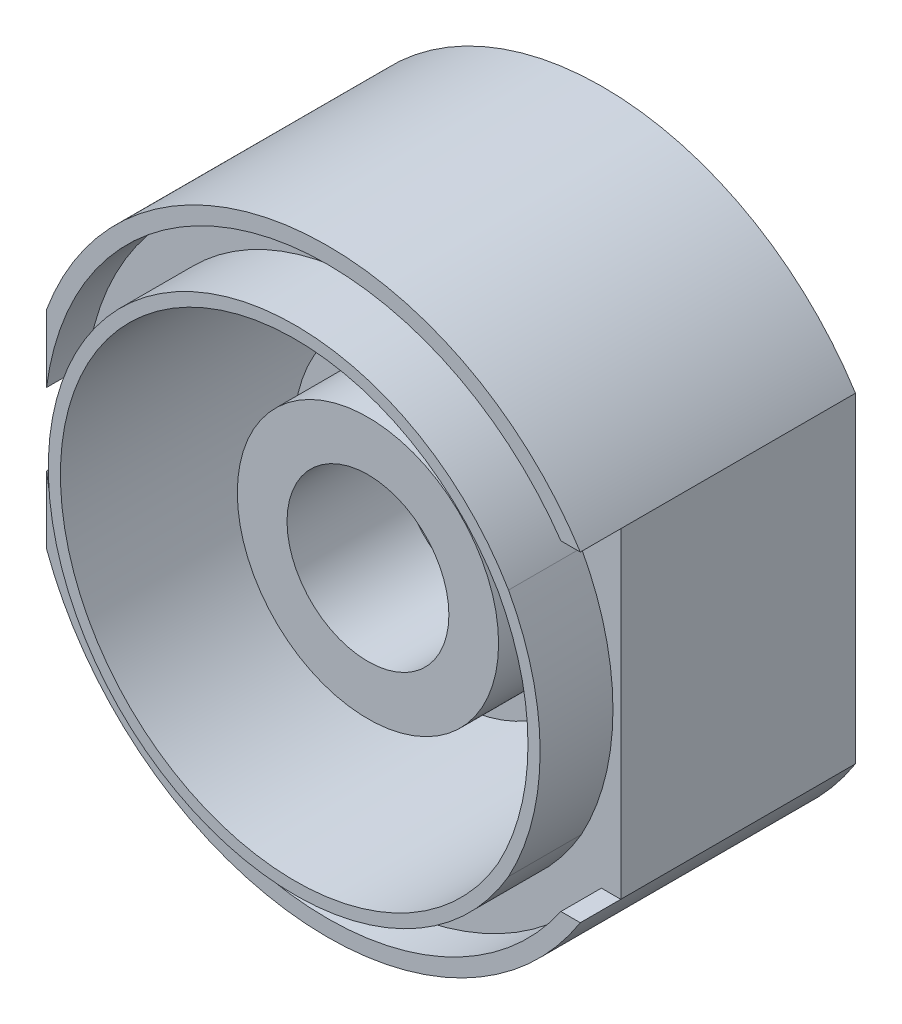
from build123d import *

# Parameters (mm, degrees)
BOSS_EXTRUDE1_DEPTH     = 17
CUT_EXTRUDE1_DEPTH      = 2.5
SKETCH5_W               = 2.5
SKETCH5_H               = 19.830535888
CUT_EXTRUDE2_DEPTH      = 2.5
EXTRUDE_THIN1_DEPTH     = 4.5
SKETCH8_R               = 8.5
CUT_EXTRUDE4_DEPTH      = 6.5
SKETCH9_R               = 5
CUT_EXTRUDE5_DEPTH      = 27.5
CUT_EXTRUDE6_DEPTH      = 0.5
CUT_EXTRUDE6_DEPTH_BACK = 1
SKETCH10_R              = 6
CUT_EXTRUDE7_START      = -12.5
SKETCH14_R              = 9.571158882
CUT_EXTRUDE7_DEPTH      = 12.5
SKETCH12_R              = 10.071158882
SKETCH12_R_2            = 8.071158882
CUT_EXTRUDE_THIN1_DEPTH = 5
SKETCH15_W              = 2.588485832
SKETCH15_H              = 17.190343429
CUT_EXTRUDE8_DEPTH      = 31.5


with BuildPart() as part:
    # Sketch1 → Boss-Extrude1 (new body)
    with BuildSketch(Plane.XY):
        with BuildLine():
            Line((17.875866164, 9.915267944), (17.875866164, -9.915267944))
            ThreePointArc((17.875866164, -9.915267944), (-16.242631254, 0), (17.875866164, 9.915267944))
        make_face()
    extrude(amount=BOSS_EXTRUDE1_DEPTH)

    # Sketch4 → Cut-Extrude1 (cut)
    with BuildSketch(Plane.XY.offset(17)):
        with BuildLine():
            Line((16.875866164, -9.620266797), (16.875866164, 9.620266797))
            ThreePointArc((16.875866164, 9.620266797), (-15.242631254, 0), (16.875866164, -9.620266797))
        make_face()
    extrude(amount=-CUT_EXTRUDE1_DEPTH, mode=Mode.SUBTRACT)

    # Sketch5 → Cut-Extrude2 (cut)
    with BuildSketch(Plane(origin=(17.875866164, 0, 0), x_dir=(0, 0, -1), z_dir=(1, 0, 0))):
        with Locations((-15.75, 0)):
            Rectangle(SKETCH5_W, SKETCH5_H)
    extrude(amount=-CUT_EXTRUDE2_DEPTH, mode=Mode.SUBTRACT)

    # Sketch6 → Extrude-Thin1 (add)
    with BuildSketch(Plane.XY.offset(14.5)):
        with BuildLine():
            ThreePointArc((15.440925449, 7.665267944), (17.39404784, 0), (15.440925449, -7.665267944))
            ThreePointArc((15.440925449, -7.665267944), (-12.992631254, 0), (15.440925449, 7.665267944))
        make_face()
        with BuildLine():
            ThreePointArc((14.787338867, 7.297249398), (16.64404784, 0), (14.787338867, -7.297249398))
            ThreePointArc((14.787338867, -7.297249398), (-12.242631254, 0), (14.787338867, 7.297249398))
        make_face(mode=Mode.SUBTRACT)
    extrude(amount=EXTRUDE_THIN1_DEPTH)

    # Sketch8 → Cut-Extrude4 (cut)
    with BuildSketch(Plane(origin=(0, 0, 0), x_dir=(-1, 0, 0), z_dir=(0, 0, -1))):
        with Locations((-2.257368746, 0)):
            Circle(SKETCH8_R)
    extrude(amount=-CUT_EXTRUDE4_DEPTH, mode=Mode.SUBTRACT)

    # Sketch9 → Cut-Extrude5 (cut)
    with BuildSketch(Plane(origin=(0, 0, 6.5), x_dir=(-1, 0, 0), z_dir=(0, 0, -1))):
        with Locations((-2.257368746, 0)):
            Circle(SKETCH9_R)
    extrude(amount=-CUT_EXTRUDE5_DEPTH, mode=Mode.SUBTRACT)

    # Sketch10 → Cut-Extrude6 (cut, two sides: drawn at the far end of the back side and taken through both)
    with BuildSketch(Plane(origin=(0, 0, 6.5), x_dir=(-1, 0, 0), z_dir=(0, 0, -1)).offset(-CUT_EXTRUDE6_DEPTH_BACK)):
        with Locations((-2.257368746, 0)):
            Circle(SKETCH10_R)
    extrude(amount=CUT_EXTRUDE6_DEPTH + CUT_EXTRUDE6_DEPTH_BACK, mode=Mode.SUBTRACT)

    # Sketch14 → Cut-Extrude7 (cut)
    with BuildSketch(Plane.XY.offset(14.5).offset(CUT_EXTRUDE7_START)):
        with BuildLine():
            ThreePointArc((14.787338867, 7.297249398), (-12.242631254, 0), (14.787338867, -7.297249398))
            ThreePointArc((14.787338867, -7.297249398), (16.64404784, 0), (14.787338867, 7.297249398))
        make_face()
        with Locations((2.257368746, 0)):
            Circle(SKETCH14_R, mode=Mode.SUBTRACT)
    extrude(amount=CUT_EXTRUDE7_DEPTH, mode=Mode.SUBTRACT)

    # Sketch12 → Cut-Extrude-Thin1 (cut)
    with BuildSketch(Plane.XY.offset(14.5)):
        with Locations((2.257368746, 0)):
            Circle(SKETCH12_R)
        with Locations((2.257368746, 0)):
            Circle(SKETCH12_R_2, mode=Mode.SUBTRACT)
    extrude(amount=-CUT_EXTRUDE_THIN1_DEPTH, mode=Mode.SUBTRACT)

    # Sketch15 → Cut-Extrude8 (cut)
    with BuildSketch(Plane.XY):
        with Locations((-16.39432519, -0.486978568)):
            Rectangle(SKETCH15_W, SKETCH15_H)
    extrude(amount=CUT_EXTRUDE8_DEPTH, mode=Mode.SUBTRACT)


solid = part.part
